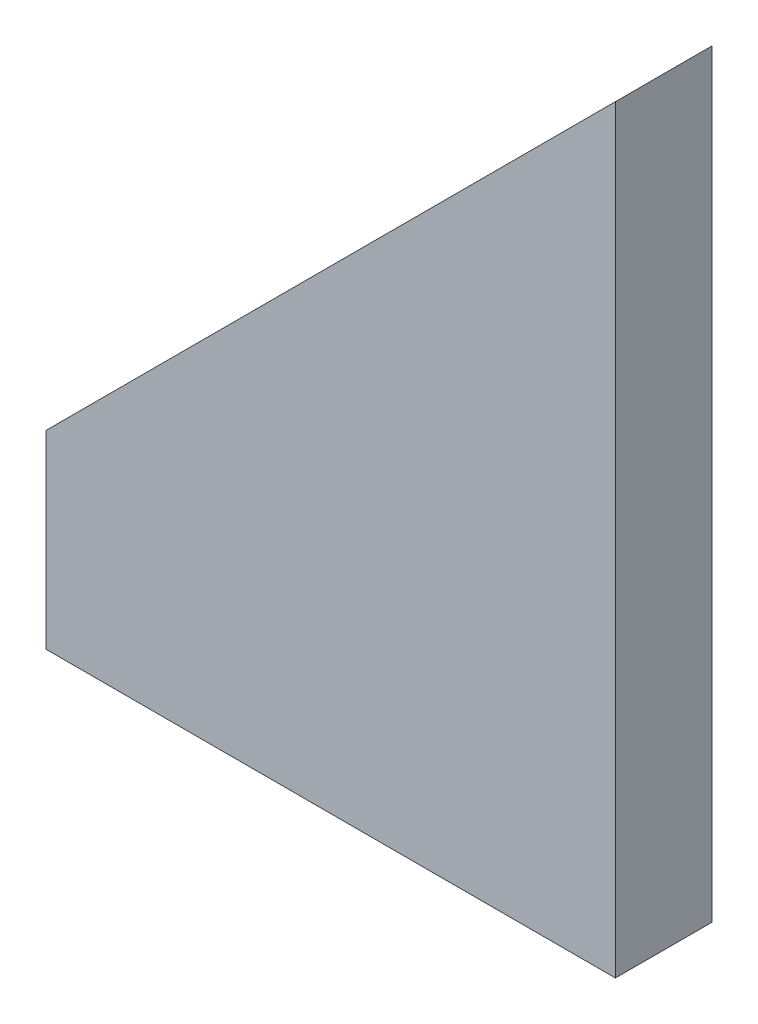
from build123d import *

# Parameters (mm, degrees)
BOSS_EXTRUDE1_DEPTH = 6.35


with BuildPart() as part:
    # Sketch1 → Boss-Extrude1 (new, symmetric)
    with BuildSketch(Plane.XY):
        Polygon((0, 0), (0, -100), (-75, -100), (-75, -75), align=None)
    extrude(amount=BOSS_EXTRUDE1_DEPTH, both=True)


solid = part.part
